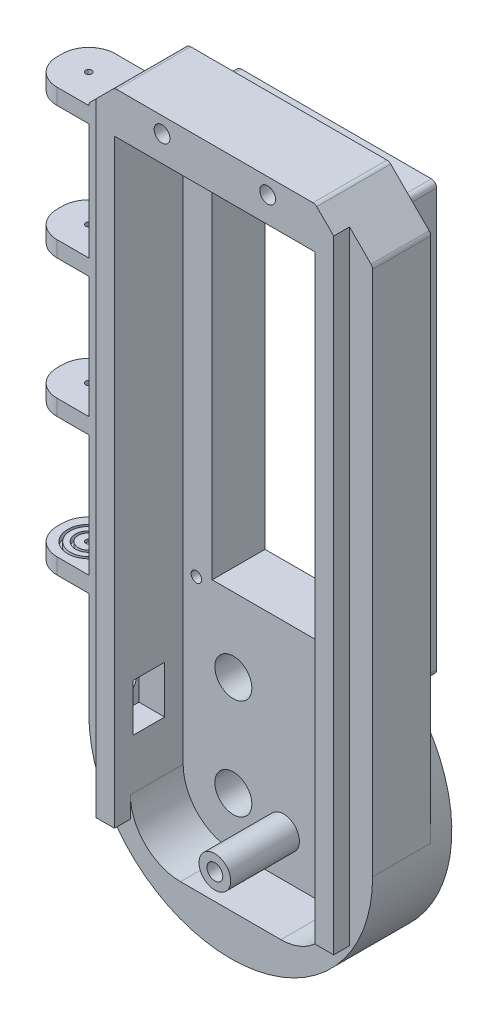
from build123d import *

# Parameters (mm, degrees)
CROQUIS1_W               = 38
CROQUIS1_H               = 81
CROQUIS1_W_2             = 27
CROQUIS1_H_2             = 72
CROQUIS1_H_3             = 38
CROQUIS1_R               = 3.5
SALIENTE_EXTRUIR1_DEPTH  = 5
CROQUIS2_W               = 38
CROQUIS2_H               = 81
CROQUIS2_W_2             = 27
CROQUIS2_H_2             = 72
SALIENTE_EXTRUIR2_DEPTH  = 5
SALIENTE_EXTRUIR9_START  = -1
SALIENTE_EXTRUIR9_DEPTH  = 1
SALIENTE_EXTRUIR10_DEPTH = 11
SALIENTE_EXTRUIR11_DEPTH = 10
REDONDEO1_R              = 1
REDONDEO2_R              = 1
REDONDEO3_R              = 1
CROQUIS6_W               = 6
CROQUIS6_H               = 9
CORTAR_EXTRUIR1_DEPTH    = 8
CROQUIS7_W               = 6
CROQUIS7_H               = 9
CROQUIS7_R               = 2.5
SALIENTE_EXTRUIR12_DEPTH = 3
SALIENTE_EXTRUIR13_DEPTH = 11
REDONDEO4_R              = 5
CROQUIS9_R               = 0.6
CORTAR_EXTRUIR2_DEPTH    = 80
SALIENTE_EXTRUIR14_START = -2.5
CROQUIS10_R              = 0.6
SALIENTE_EXTRUIR14_DEPTH = 2.5
CROQUIS11_R              = 4
CROQUIS11_R_2            = 3.5
CROQUIS11_R_3            = 2.5
CROQUIS11_R_4            = 2
CORTAR_EXTRUIR3_DEPTH    = 1
SALIENTE_EXTRUIR15_DEPTH = 3
CROQUIS14_R              = 1.5
CORTAR_EXTRUIR4_DEPTH    = 14
CROQUIS16_W              = 3.5
CROQUIS16_H              = 3
SALIENTE_EXTRUIR16_DEPTH = 4
CROQUIS25_R              = 3
CROQUIS25_R_2            = 1.5
SALIENTE_EXTRUIR21_DEPTH = 18
CROQUIS26_R              = 1.5
CORTAR_EXTRUIR7_DEPTH    = 18
CROQUIS28_R              = 1
CORTAR_EXTRUIR8_DEPTH    = 4


with BuildPart() as part:
    # Croquis1 → Saliente-Extruir1 (new body)
    # profile 1 of 5: a face of its own
    with BuildSketch(Plane.XY):
        Rectangle(CROQUIS1_W, CROQUIS1_H)
        Rectangle(CROQUIS1_W_2, CROQUIS1_H_2, mode=Mode.SUBTRACT)
    # profile 2 of 5: a face of its own
    with BuildSketch(Plane.XY):
        with Locations((0, -59.5)):
            Rectangle(CROQUIS1_W, CROQUIS1_H_3)
        with Locations((-9.5, -69)):
            Circle(CROQUIS1_R, mode=Mode.SUBTRACT)
        with Locations((9.5, -59.5)):
            Circle(CROQUIS1_R, mode=Mode.SUBTRACT)
        with Locations((-9.5, -50)):
            Circle(CROQUIS1_R, mode=Mode.SUBTRACT)
    # profile 3 of 5: a face of its own
    with BuildSketch(Plane.XY):
        with BuildLine():
            ThreePointArc((19, -78.5), (26.870057685, -59.5), (19, -40.5))
            Line((19, -40.5), (19, -78.5))
        make_face()
    # profile 4 of 5: a face of its own
    with BuildSketch(Plane.XY):
        with BuildLine():
            Line((19, -78.5), (-19, -78.5))
            ThreePointArc((-19, -78.5), (0, -86.370057685), (19, -78.5))
        make_face()
    # profile 5 of 5: a face of its own
    with BuildSketch(Plane.XY):
        with BuildLine():
            Line((-19, -78.5), (-19, -40.5))
            ThreePointArc((-19, -40.5), (-26.870057685, -59.5), (-19, -78.5))
        make_face()
    extrude(amount=SALIENTE_EXTRUIR1_DEPTH)

    # Croquis2 → Saliente-Extruir2 (add)
    with BuildSketch(Plane(origin=(0, 0, 0), x_dir=(-1, 0, 0), z_dir=(0, 0, -1))):
        Rectangle(CROQUIS2_W, CROQUIS2_H)
        Rectangle(CROQUIS2_W_2, CROQUIS2_H_2, mode=Mode.SUBTRACT)
    extrude(amount=SALIENTE_EXTRUIR2_DEPTH)

    # Croquis3 → Saliente-Extruir9 (add)
    with BuildSketch(Plane.XY.offset(5).offset(SALIENTE_EXTRUIR9_START)):
        with BuildLine():
            Line((26.870057685, -59.5), (26.870057685, 40.5))
            Line((26.870057685, 40.5), (19, 48.370057685))
            Line((19, 48.370057685), (-19, 48.370057685))
            Line((-19, 48.370057685), (-26.870057685, 40.5))
            Line((-26.870057685, 40.5), (-26.870057685, -59.5))
            ThreePointArc((-26.870057685, -59.5), (0, -86.370057685), (26.870057685, -59.5))
        make_face()
        with BuildLine():
            Line((19, -59.5), (19, 40.5))
            Line((19, 40.5), (-19, 40.5))
            Line((-19, 40.5), (-19, -59.5))
            ThreePointArc((-19, -59.5), (0, -78.5), (19, -59.5))
        make_face(mode=Mode.SUBTRACT)
    extrude(amount=SALIENTE_EXTRUIR9_DEPTH)

    # Croquis4 → Saliente-Extruir10 (add)
    with BuildSketch(Plane(origin=(0, 0, 4), x_dir=(-1, 0, 0), z_dir=(0, 0, -1))):
        with BuildLine():
            Line((19, 40.5), (19, -40.5))
            ThreePointArc((19, -40.5), (24.824696333, -49.217274097), (26.870057685, -59.5))
            Line((26.870057685, -59.5), (26.870057685, 40.5))
            Line((26.870057685, 40.5), (19, 48.370057685))
            Line((19, 48.370057685), (-19, 48.370057685))
            Line((-19, 48.370057685), (-26.870057685, 40.5))
            Line((-26.870057685, 40.5), (-26.870057685, -59.5))
            ThreePointArc((-26.870057685, -59.5), (-24.824696333, -49.217274097), (-19, -40.5))
            Line((-19, -40.5), (-19, 40.5))
            Line((-19, 40.5), (19, 40.5))
        make_face()
    extrude(amount=-SALIENTE_EXTRUIR10_DEPTH)

    # Croquis5 → Saliente-Extruir11 (add)
    with BuildSketch(Plane.XY.offset(5)):
        with BuildLine():
            Line((-19, -59.5), (-19, -69))
            ThreePointArc((-19, -69), (-16.217514421, -75.717514421), (-9.5, -78.5))
            Line((-9.5, -78.5), (9.5, -78.5))
            ThreePointArc((9.5, -78.5), (16.217514421, -75.717514421), (19, -69))
            Line((19, -69), (19, -59.5))
            Line((19, -59.5), (19, -40.5))
            ThreePointArc((19, -40.5), (0, -86.370057685), (-19, -40.5))
            Line((-19, -40.5), (-19, -59.5))
        make_face()
    extrude(amount=SALIENTE_EXTRUIR11_DEPTH)

    # Redondeo1
    redondeo1_edges = [part.edges().sort_by_distance(p)[0] for p in [
        (19, -40.5, -2.5),
        (-19, -40.5, -2.5),
        (19, 40.5, -0.5),
        (-19, 40.5, -0.5),
    ]]
    fillet(redondeo1_edges, radius=REDONDEO1_R)

    # Redondeo2
    redondeo2_edges = [part.edges().sort_by_distance(p)[0] for p in [
        (-19, -0.5, 4),
        (0, 40.5, 4),
        (-18.707106781, 40.207106781, 4),
        (18.707106781, 40.207106781, 4),
        (19, -0.5, 4),
    ]]
    fillet(redondeo2_edges, radius=REDONDEO2_R)

    # Redondeo3
    redondeo3_edges = [part.edges().sort_by_distance(p)[0] for p in [
        (19, 48.370057685, 9.5),
        (26.870057685, 40.5, 9.5),
        (-26.870057685, 40.5, 9.5),
        (-19, 48.370057685, 9.5),
    ]]
    fillet(redondeo3_edges, radius=REDONDEO3_R)

    # Croquis6 → Cortar-Extruir1 (cut)
    with BuildSketch(Plane.ZY.offset(26.870057685)):
        with Locations((11.5, -55)):
            Rectangle(CROQUIS6_W, CROQUIS6_H)
    extrude(amount=-CORTAR_EXTRUIR1_DEPTH, mode=Mode.SUBTRACT)

    # Croquis7 → Saliente-Extruir12 (add)
    with BuildSketch(Plane.ZY.offset(26.870057685)):
        with Locations((11.5, -55)):
            Rectangle(CROQUIS7_W, CROQUIS7_H)
        with Locations((11.5, -55)):
            Circle(CROQUIS7_R, mode=Mode.SUBTRACT)
    extrude(amount=-SALIENTE_EXTRUIR12_DEPTH)

    # Croquis8 → Saliente-Extruir13 (add)
    with BuildSketch(Plane.ZY.offset(26.870057685)):
        Polygon((15, 40.085786438), (4, 40.085786438), (4, 37.085786438), (9.5, 37.085786438), (15, 37.085786438), align=None)
        Polygon((9.5, 15.085786438), (4, 15.085786438), (4, 12.085786438), (9.5, 12.085786438), (15, 12.085786438), (15, 15.085786438), align=None)
        Polygon((9.5, -10.914213562), (4, -10.914213562), (4, -13.914213562), (9.5, -13.914213562), (15, -13.914213562), (15, -10.914213562), align=None)
        Polygon((9.5, -36.914213562), (4, -36.914213562), (4, -39.914213562), (15, -39.914213562), (15, -36.914213562), align=None)
    extrude(amount=SALIENTE_EXTRUIR13_DEPTH)

    # Redondeo4
    redondeo4_edges = [part.edges().sort_by_distance(p)[0] for p in [
        (-37.870057685, 38.585786438, 4),
        (-37.870057685, 38.585786438, 15),
        (-37.870057685, 13.585786438, 4),
        (-37.870057685, 13.585786438, 15),
        (-37.870057685, -12.414213562, 4),
        (-37.870057685, -12.414213562, 15),
        (-37.870057685, -38.414213562, 4),
        (-37.870057685, -38.414213562, 15),
    ]]
    fillet(redondeo4_edges, radius=REDONDEO4_R)

    # Croquis9 → Cortar-Extruir2 (cut)
    with BuildSketch(Plane(origin=(0, 40.085786438, 0), x_dir=(1, 0, 0), z_dir=(0, 1, 0))):
        with Locations(Location((-32.370057685, -9.5, 0), (0, 0, 270))):
            Circle(CROQUIS9_R)
    extrude(amount=-CORTAR_EXTRUIR2_DEPTH, mode=Mode.SUBTRACT)

    # Croquis10 → Saliente-Extruir14 (add)
    with BuildSketch(Plane.XZ.offset(39.914213562).offset(SALIENTE_EXTRUIR14_START)):
        with Locations(Location((-32.370057685, 9.5, 0), (0, 0, 90))):
            Circle(CROQUIS10_R)
    extrude(amount=SALIENTE_EXTRUIR14_DEPTH)

    # Croquis11 → Cortar-Extruir3 (cut)
    # profile 1 of 2: a face of its own
    with BuildSketch(Plane(origin=(0, -36.914213562, 0), x_dir=(1, 0, 0), z_dir=(0, 1, 0))):
        with Locations(Location((-32.370057685, -9.5, 0), (0, 0, 270))):
            Circle(CROQUIS11_R)
        with Locations(Location((-32.370057685, -9.5, 0), (0, 0, 270))):
            Circle(CROQUIS11_R_2, mode=Mode.SUBTRACT)
    # profile 2 of 2: a face of its own
    with BuildSketch(Plane(origin=(0, -36.914213562, 0), x_dir=(1, 0, 0), z_dir=(0, 1, 0))):
        with Locations(Location((-32.370057685, -9.5, 0), (0, 0, 270))):
            Circle(CROQUIS11_R_3)
        with Locations(Location((-32.370057685, -9.5, 0), (0, 0, 270))):
            Circle(CROQUIS11_R_4, mode=Mode.SUBTRACT)
    extrude(amount=-CORTAR_EXTRUIR3_DEPTH, mode=Mode.SUBTRACT)

    # Croquis13 → Saliente-Extruir15 (add)
    with BuildSketch(Plane.XY.offset(15)):
        Polygon((-19, -65.5), (-19, 40.5), (-22.5, 40.5), (-22.5, -69), (-19, -69), align=None)
        Polygon((22.5, 40.5), (19, 40.5), (19, -65.5), (19, -69), (22.5, -69), align=None)
        with BuildLine():
            Line((-19, 40.5), (19, 40.5))
            Line((19, 40.5), (22.5, 40.5))
            Line((22.5, 40.5), (22.5, 44.870057685))
            Line((22.5, 44.870057685), (19.292893219, 48.077164466))
            ThreePointArc((19.292893219, 48.077164466), (18.96846987, 48.293937218), (18.585786438, 48.370057685))
            Line((18.585786438, 48.370057685), (-18.585786438, 48.370057685))
            ThreePointArc((-18.585786438, 48.370057685), (-18.96846987, 48.293937218), (-19.292893219, 48.077164466))
            Line((-19.292893219, 48.077164466), (-22.5, 44.870057685))
            Line((-22.5, 44.870057685), (-22.5, 40.5))
            Line((-22.5, 40.5), (-19, 40.5))
        make_face()
    extrude(amount=SALIENTE_EXTRUIR15_DEPTH)

    # Croquis14 → Cortar-Extruir4 (cut)
    with BuildSketch(Plane(origin=(0, 0, 4), x_dir=(-1, 0, 0), z_dir=(0, 0, -1))):
        with Locations((10, 45.370057685)):
            Circle(CROQUIS14_R)
        with Locations(Location((-10, 45.370057685, 0), (0, 0, 180))):
            Circle(CROQUIS14_R)
    extrude(amount=-CORTAR_EXTRUIR4_DEPTH, mode=Mode.SUBTRACT)

    # Croquis16 → Saliente-Extruir16 (add)
    with BuildSketch(Plane(origin=(0, -69, 0), x_dir=(-1, 0, 0), z_dir=(0, -1, 0))):
        with Locations((20.75, -16.5)):
            Rectangle(CROQUIS16_W, CROQUIS16_H)
        with Locations((-20.75, -16.5)):
            Rectangle(CROQUIS16_W, CROQUIS16_H)
    extrude(amount=SALIENTE_EXTRUIR16_DEPTH)

    # Croquis25 → Saliente-Extruir21 (add)
    with BuildSketch(Plane.XY.offset(18)):
        with Locations((0, -70.629942315)):
            Circle(CROQUIS25_R)
        with Locations((0, -70.629942315)):
            Circle(CROQUIS25_R_2, mode=Mode.SUBTRACT)
    extrude(amount=-SALIENTE_EXTRUIR21_DEPTH)

    # Croquis26 → Cortar-Extruir7 (cut)
    with BuildSketch(Plane.XY.offset(18)):
        with Locations((0, -70.629942315)):
            Circle(CROQUIS26_R)
    extrude(amount=-CORTAR_EXTRUIR7_DEPTH, mode=Mode.SUBTRACT)

    # Croquis28 → Cortar-Extruir8 (cut)
    with BuildSketch(Plane.XY.offset(5)):
        with Locations((-16.5, 38)):
            Circle(CROQUIS28_R)
        with Locations((14.5, 38)):
            Circle(CROQUIS28_R)
        with Locations((14.5, -37)):
            Circle(CROQUIS28_R)
        with Locations((-16.5, -37)):
            Circle(CROQUIS28_R)
    extrude(amount=-CORTAR_EXTRUIR8_DEPTH, mode=Mode.SUBTRACT)


solid = part.part
